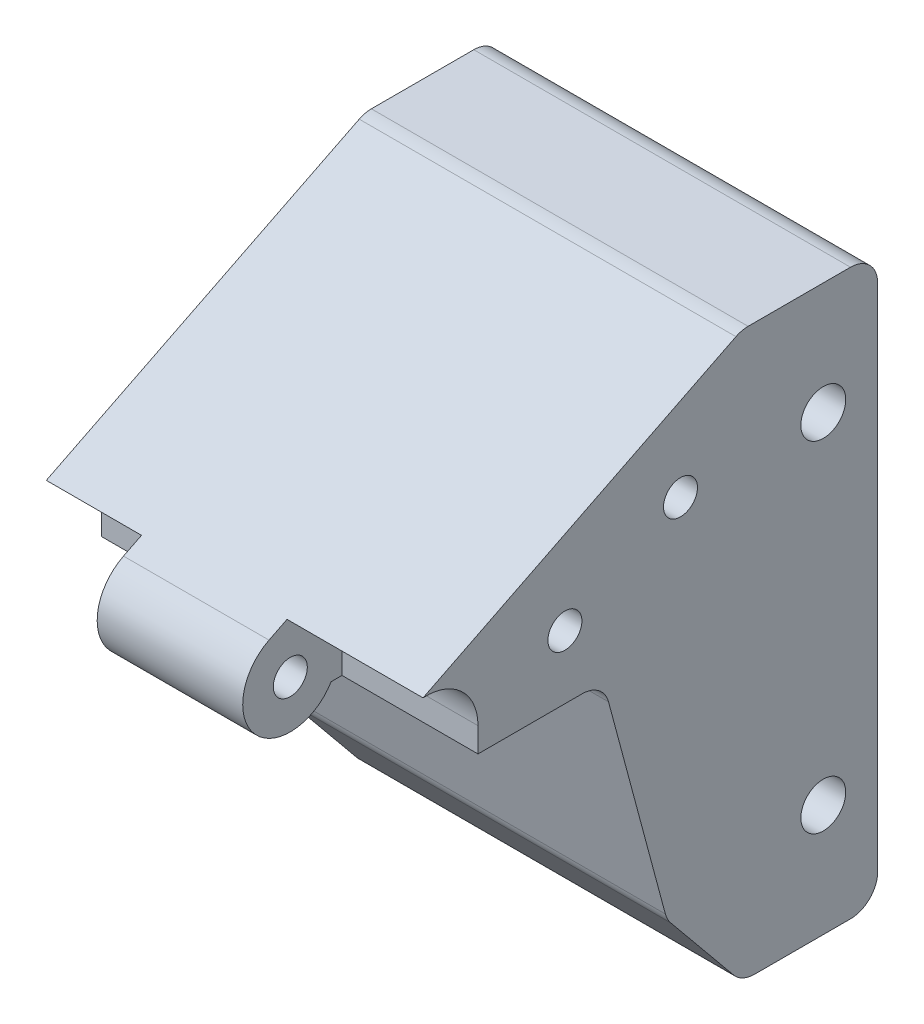
from build123d import *

# Parameters (mm, degrees)
SKETCH1_W                       = 27.7
SKETCH1_H                       = 41.5
BOSS_EXTRUDE1_DEPTH             = 10
CUT_EXTRUDE2_DEPTH              = 27.877220838
CUT_EXTRUDE2_DEPTH_BACK         = 27.877220838
SKETCH2_R                       = 1.65
BOSS_EXTRUDE2_REACH             = 28.877
SKETCH3_R                       = 1.25
BOSS_EXTRUDE2_DIRECTION_2_REACH = 28.877
CUT_EXTRUDE3_START              = -7
SKETCH4_R                       = 1.25
CUT_EXTRUDE3_DEPTH              = 7
SKETCH6_R                       = 1.25
CUT_EXTRUDE5_DEPTH              = 10
SKETCH5_R                       = 1.25
CUT_EXTRUDE4_DEPTH              = 51.438166105
FILLET1_R                       = 2


with BuildPart() as part:
    # Sketch1 → Boss-Extrude1 (new body)
    with BuildSketch(Plane.XY):
        Rectangle(SKETCH1_W, SKETCH1_H)
    extrude(amount=BOSS_EXTRUDE1_DEPTH)

    # Sketch2 → Cut-Extrude2 (cut, two sides: drawn at the far end of the back side and taken through both)
    with BuildSketch(Plane(origin=(0, 0, 0), x_dir=(0, 0, -1), z_dir=(1, 0, 0)).offset(-CUT_EXTRUDE2_DEPTH_BACK)):
        with Locations((-4, 12.5)):
            Circle(SKETCH2_R)
        with Locations((-4, -12.5)):
            Circle(SKETCH2_R)
    extrude(amount=CUT_EXTRUDE2_DEPTH + CUT_EXTRUDE2_DEPTH_BACK, mode=Mode.SUBTRACT)

    # Boss-Extrude2: up to this face of the body (flat: up to its plane)
    boss_extrude2_end = Plane(part.part.faces().sort_by_distance((-13.85, 0, 5.042991276))[0])
    # Sketch3 → Boss-Extrude2 (add, up to the picked face)
    with BuildSketch(Plane(origin=(0, 0, 0), x_dir=(0, 0, -1), z_dir=(1, 0, 0)), mode=Mode.PRIVATE) as boss_extrude2_sk1:
        Polygon((-15.5, -14.05), (-10, -14.05), (-10, 3.45), (-20.188333796, 3.45), align=None)
    boss_extrude2_tool1 = split(extrude(boss_extrude2_sk1.sketch, amount=-BOSS_EXTRUDE2_REACH, mode=Mode.PRIVATE), bisect_by=boss_extrude2_end, keep=Keep.BOTH, mode=Mode.PRIVATE)
    # Sketch3 → Boss-Extrude2 (add, up to the picked face)
    with BuildSketch(Plane(origin=(0, 0, 0), x_dir=(0, 0, -1), z_dir=(1, 0, 0)), mode=Mode.PRIVATE) as boss_extrude2_sk2:
        with BuildLine():
            Line((-20.188333796, 3.45), (-10, 3.45))
            Line((-10, 3.45), (-10, 20.75))
            Line((-10, 20.75), (-34.754426044, 8.380905804))
            ThreePointArc((-34.754426044, 8.380905804), (-35.758048448, 2.871948872), (-30.188333796, 3.45))
            Line((-30.188333796, 3.45), (-20.188333796, 3.45))
        make_face()
        with Locations(Location((-33.19, 5.25, 0), (0, 0, 90))):
            Circle(SKETCH3_R, mode=Mode.SUBTRACT)
    boss_extrude2_tool2 = split(extrude(boss_extrude2_sk2.sketch, amount=-BOSS_EXTRUDE2_REACH, mode=Mode.PRIVATE), bisect_by=boss_extrude2_end, keep=Keep.BOTH, mode=Mode.PRIVATE)
    # Sketch3 → Boss-Extrude2 (add, up to the picked face)
    with BuildSketch(Plane(origin=(0, 0, 0), x_dir=(0, 0, -1), z_dir=(1, 0, 0)), mode=Mode.PRIVATE) as boss_extrude2_sk3:
        Polygon((-10, -14.05), (-10, -20.75), (-15.5, -14.05), align=None)
    boss_extrude2_tool3 = split(extrude(boss_extrude2_sk3.sketch, amount=-BOSS_EXTRUDE2_REACH, mode=Mode.PRIVATE), bisect_by=boss_extrude2_end, keep=Keep.BOTH, mode=Mode.PRIVATE)
    add(boss_extrude2_tool1.solids().sort_by(Axis((0, -4.428377, 14.038839), (-1, 0, 0)))[0])
    add(boss_extrude2_tool2.solids().sort_by(Axis((0, 9.377547, 20.597774), (-1, 0, 0)))[0])
    add(boss_extrude2_tool3.solids().sort_by(Axis((0, -16.283333, 11.833333), (-1, 0, 0)))[0])

    # Boss-Extrude2 direction 2: up to this face of the body (flat: up to its plane)
    boss_extrude2_direction_2_end = Plane(part.part.faces().sort_by_distance((13.85, 0, 5.042991276))[0])
    # Sketch3 → Boss-Extrude2 direction 2 (add, up to the picked face)
    with BuildSketch(Plane(origin=(0, 0, 0), x_dir=(0, 0, -1), z_dir=(1, 0, 0)), mode=Mode.PRIVATE) as boss_extrude2_direction_2_sk1:
        Polygon((-15.5, -14.05), (-10, -14.05), (-10, 3.45), (-20.188333796, 3.45), align=None)
    boss_extrude2_direction_2_tool1 = split(extrude(boss_extrude2_direction_2_sk1.sketch, amount=BOSS_EXTRUDE2_DIRECTION_2_REACH, mode=Mode.PRIVATE), bisect_by=boss_extrude2_direction_2_end, keep=Keep.BOTH, mode=Mode.PRIVATE)
    # Sketch3 → Boss-Extrude2 direction 2 (add, up to the picked face)
    with BuildSketch(Plane(origin=(0, 0, 0), x_dir=(0, 0, -1), z_dir=(1, 0, 0)), mode=Mode.PRIVATE) as boss_extrude2_direction_2_sk2:
        with BuildLine():
            Line((-20.188333796, 3.45), (-10, 3.45))
            Line((-10, 3.45), (-10, 20.75))
            Line((-10, 20.75), (-34.754426044, 8.380905804))
            ThreePointArc((-34.754426044, 8.380905804), (-35.758048448, 2.871948872), (-30.188333796, 3.45))
            Line((-30.188333796, 3.45), (-20.188333796, 3.45))
        make_face()
        with Locations(Location((-33.19, 5.25, 0), (0, 0, 90))):
            Circle(SKETCH3_R, mode=Mode.SUBTRACT)
    boss_extrude2_direction_2_tool2 = split(extrude(boss_extrude2_direction_2_sk2.sketch, amount=BOSS_EXTRUDE2_DIRECTION_2_REACH, mode=Mode.PRIVATE), bisect_by=boss_extrude2_direction_2_end, keep=Keep.BOTH, mode=Mode.PRIVATE)
    # Sketch3 → Boss-Extrude2 direction 2 (add, up to the picked face)
    with BuildSketch(Plane(origin=(0, 0, 0), x_dir=(0, 0, -1), z_dir=(1, 0, 0)), mode=Mode.PRIVATE) as boss_extrude2_direction_2_sk3:
        Polygon((-10, -14.05), (-10, -20.75), (-15.5, -14.05), align=None)
    boss_extrude2_direction_2_tool3 = split(extrude(boss_extrude2_direction_2_sk3.sketch, amount=BOSS_EXTRUDE2_DIRECTION_2_REACH, mode=Mode.PRIVATE), bisect_by=boss_extrude2_direction_2_end, keep=Keep.BOTH, mode=Mode.PRIVATE)
    add(boss_extrude2_direction_2_tool1.solids().sort_by(Axis((0, -4.428377, 14.038839), (1, 0, 0)))[0])
    add(boss_extrude2_direction_2_tool2.solids().sort_by(Axis((0, 9.377547, 20.597774), (1, 0, 0)))[0])
    add(boss_extrude2_direction_2_tool3.solids().sort_by(Axis((0, -16.283333, 11.833333), (1, 0, 0)))[0])

    # Sketch4 → Cut-Extrude3 (cut)
    # profile 1 of 5: a face of its own
    with BuildSketch(Plane.ZY.offset(13.85).offset(CUT_EXTRUDE3_START)):
        with BuildLine():
            ThreePointArc((34.754426044, 8.380905804), (30.621951552, 7.628051128), (30.188333796, 3.45))
            ThreePointArc((30.188333796, 3.45), (34.123854455, 1.876883361), (36.69, 5.25))
            ThreePointArc((36.69, 5.25), (36.167036375, 7.090449517), (34.754426044, 8.380905804))
        make_face()
        with Locations(Location((33.19, 5.25, 0), (0, 0, 270))):
            Circle(SKETCH4_R, mode=Mode.SUBTRACT)
    # profile 2 of 5: a face of its own
    with BuildSketch(Plane.ZY.offset(13.85).offset(CUT_EXTRUDE3_START)):
        with BuildLine():
            ThreePointArc((29.39, 5.25), (29.505082606, 4.321892356), (29.843359894, 3.45))
            Line((29.843359894, 3.45), (30.188333796, 3.45))
            ThreePointArc((30.188333796, 3.45), (30.621951552, 7.628051128), (34.754426044, 8.380905804))
            Line((34.754426044, 8.380905804), (33.430621051, 9.042374126))
            ThreePointArc((33.430621051, 9.042374126), (30.589457748, 8.020772455), (29.39, 5.25))
        make_face()
    # profile 3 of 5: a face of its own
    with BuildSketch(Plane.ZY.offset(13.85).offset(CUT_EXTRUDE3_START)):
        with BuildLine():
            Line((30.188333796, 3.45), (29.843359894, 3.45))
            ThreePointArc((29.843359894, 3.45), (34.118107644, 1.565082606), (36.99, 5.25))
            ThreePointArc((36.99, 5.25), (35.960772455, 7.850542252), (33.430621051, 9.042374126))
            Line((33.430621051, 9.042374126), (34.754426044, 8.380905804))
            ThreePointArc((34.754426044, 8.380905804), (36.167036375, 7.090449517), (36.69, 5.25))
            ThreePointArc((36.69, 5.25), (34.123854455, 1.876883361), (30.188333796, 3.45))
        make_face()
    # profile 4 of 5: a face of its own
    with BuildSketch(Plane.ZY.offset(13.85).offset(CUT_EXTRUDE3_START)):
        with BuildLine():
            Line((30.188333796, 3.45), (29.843359894, 3.45))
            ThreePointArc((29.843359894, 3.45), (34.118107644, 1.565082606), (36.99, 5.25))
            ThreePointArc((36.99, 5.25), (35.960772455, 7.850542252), (33.430621051, 9.042374126))
            Line((33.430621051, 9.042374126), (34.754426044, 8.380905804))
            ThreePointArc((34.754426044, 8.380905804), (36.167036375, 7.090449517), (36.69, 5.25))
            ThreePointArc((36.69, 5.25), (34.123854455, 1.876883361), (30.188333796, 3.45))
        make_face()
    # profile 5 of 5: a face of its own
    with BuildSketch(Plane.ZY.offset(13.85).offset(CUT_EXTRUDE3_START)):
        with BuildLine():
            Line((29.39, 5.25), (29.39, 3.45))
            Line((29.39, 3.45), (29.843359894, 3.45))
            ThreePointArc((29.843359894, 3.45), (29.505082606, 4.321892356), (29.39, 5.25))
        make_face()
    extrude(amount=CUT_EXTRUDE3_DEPTH, mode=Mode.SUBTRACT)

    # Sketch6 → Cut-Extrude5 (cut)
    # profile 1 of 3: a face of its own
    with BuildSketch(Plane(origin=(13.85, 0, 0), x_dir=(0, 0, -1), z_dir=(1, 0, 0))):
        with BuildLine():
            ThreePointArc((-33.430621051, 9.042374126), (-36.388515387, 3.19829356), (-29.843359894, 3.45))
            Line((-29.843359894, 3.45), (-30.188333796, 3.45))
            ThreePointArc((-30.188333796, 3.45), (-35.758048448, 2.871948872), (-34.754426044, 8.380905804))
            Line((-34.754426044, 8.380905804), (-33.430621051, 9.042374126))
        make_face()
    # profile 2 of 3: a face of its own
    with BuildSketch(Plane(origin=(13.85, 0, 0), x_dir=(0, 0, -1), z_dir=(1, 0, 0))):
        with BuildLine():
            Line((-30.188333796, 3.45), (-29.843359894, 3.45))
            ThreePointArc((-29.843359894, 3.45), (-29.505082606, 4.321892356), (-29.39, 5.25))
            ThreePointArc((-29.39, 5.25), (-30.589457748, 8.020772455), (-33.430621051, 9.042374126))
            Line((-33.430621051, 9.042374126), (-34.754426044, 8.380905804))
            ThreePointArc((-34.754426044, 8.380905804), (-35.758048448, 2.871948872), (-30.188333796, 3.45))
        make_face()
        with Locations(Location((-33.19, 5.25, 0), (0, 0, 90))):
            Circle(SKETCH6_R, mode=Mode.SUBTRACT)
    # profile 3 of 3: a face of its own
    with BuildSketch(Plane(origin=(13.85, 0, 0), x_dir=(0, 0, -1), z_dir=(1, 0, 0))):
        with BuildLine():
            Line((-29.843359894, 3.45), (-29.39, 3.45))
            Line((-29.39, 3.45), (-29.39, 5.25))
            ThreePointArc((-29.39, 5.25), (-29.505082606, 4.321892356), (-29.843359894, 3.45))
        make_face()
    extrude(amount=-CUT_EXTRUDE5_DEPTH, mode=Mode.SUBTRACT)

    # Sketch5 → Cut-Extrude4 (cut, through all)
    with BuildSketch(Plane.ZY.offset(13.85)):
        with Locations(Location((14.5, 12.353095448, 0), (0, 0, 270))):
            Circle(SKETCH5_R)
        with Locations(Location((22.999243301, 8.106261334, 0), (0, 0, 270))):
            Circle(SKETCH5_R)
    extrude(amount=-CUT_EXTRUDE4_DEPTH, mode=Mode.SUBTRACT)

    # Fillet1
    fillet1_edges = [part.edges().sort_by_distance(p)[0] for p in [
        (0, 20.75, 10),
        (0, 3.45, 20.188333796),
        (0, -14.05, 15.5),
        (0, 20.75, 0),
        (0, -20.75, 0),
        (0, -20.75, 10),
    ]]
    fillet(fillet1_edges, radius=FILLET1_R)


solid = part.part
